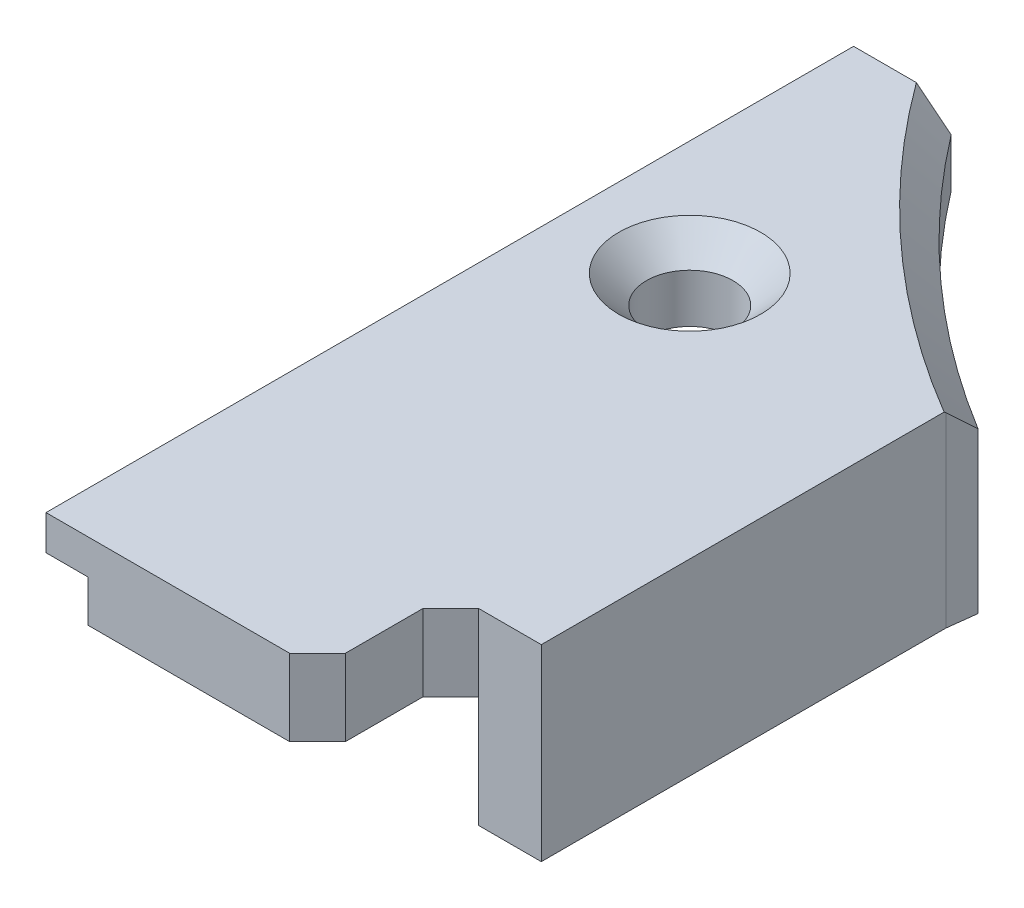
from build123d import *

# Parameters (mm, degrees)
SKETCH_234_R           = 1.55
EXTRUDE_1_DEPTH        = 2.75
SKETCH_923_W           = 10.000000002
SKETCH_923_H           = 4.75
EXTRUDE_2_DEPTH        = 2.75
SKETCH_1070_W          = 1
SKETCH_1070_H          = 6.95
EXTRUDE_1769_DEPTH     = 2.75
PCB_START              = -4
SKETCH_6_W             = 1
SKETCH_6_H             = 6.95
PCB_DEPTH              = 4
SKETCH_4_W             = 1.75
SKETCH_4_H             = 28.99988509
CUT_EXTRUDE_2211_DEPTH = 1.5
SKETCH_5_W             = 0.25
SKETCH_5_H             = 28.99988509
CUT_EXTRUDE_2_DEPTH    = 33.350081892
CHAMFER_1_SIZE         = 1
CHAMFER_2_SIZE         = 1
CUT_EXTRUDE_4_DEPTH    = 4


with BuildPart() as part:
    # Sketch 234 → 底座-1 (new body)
    with BuildSketch(Plane(origin=(0, 0, 0), x_dir=(1, 0, 0), z_dir=(0, 1, 0))):
        with BuildLine():
            Line((22.500000002, -14.24988509), (22.500000002, -7.263629174))
            Line((22.500000002, -7.263629174), (24.500000002, -7.263629174))
            Line((24.500000002, -7.263629174), (24.500000002, 0.312480077))
            Line((24.500000002, 0.312480077), (24.715186194, 2.08073674))
            ThreePointArc((24.715186194, 2.08073674), (20.15501929, 5.688743466), (16.252981126, 10))
            Line((16.252981126, 10), (12.5, 10))
            Line((12.5, 10), (12.5, -14.24988509))
            Line((12.5, -14.24988509), (22.500000002, -14.24988509))
        make_face()
        with Locations(Location((16.865979255, 0, 0), (0, 0, 270))):
            Circle(SKETCH_234_R, mode=Mode.SUBTRACT)
    extrude(amount=EXTRUDE_1_DEPTH)

    # Sketch 923 → 底座-2 (add)
    with BuildSketch(Plane(origin=(0, 0, 0), x_dir=(1, 0, 0), z_dir=(0, 1, 0))):
        with Locations((17.500000001, -16.62488509)):
            Rectangle(SKETCH_923_W, SKETCH_923_H)
    extrude(amount=EXTRUDE_2_DEPTH)

    # Sketch 1070 → Extrude 1769 (add)
    with BuildSketch(Plane(origin=(0, 0, 0), x_dir=(1, 0, 0), z_dir=(0, 1, 0))):
        with BuildLine():
            ThreePointArc((24.715186194, 2.08073674), (25.291636518, 1.705823535), (25.875319612, 1.342273079))
            Line((25.875319612, 1.342273079), (25.750000002, 0.312480077))
            Line((25.750000002, 0.312480077), (25.750000002, -14.213629174))
            Line((25.750000002, -14.213629174), (24.500000002, -14.213629174))
            Line((24.500000002, -14.213629174), (24.500000002, -7.263629174))
            Line((24.500000002, -7.263629174), (24.500000002, 0.312480077))
            Line((24.500000002, 0.312480077), (24.715186194, 2.08073674))
        make_face()
        with Locations((24.000000002, -10.738629174)):
            Rectangle(SKETCH_1070_W, SKETCH_1070_H)
        with Locations((23.000000002, -10.738629174)):
            Rectangle(SKETCH_1070_W, SKETCH_1070_H)
    extrude(amount=EXTRUDE_1769_DEPTH)

    # Sketch 6 → 底座卡榫-注意PCB突出部分 (add)
    with BuildSketch(Plane(origin=(0, 0, 0), x_dir=(1, 0, 0), z_dir=(0, 1, 0)).offset(PCB_START)):
        with Locations((24.000000002, -10.738629174)):
            Rectangle(SKETCH_6_W, SKETCH_6_H)
        with BuildLine():
            ThreePointArc((24.715186194, 2.08073674), (25.291636518, 1.705823535), (25.875319612, 1.342273079))
            Line((25.875319612, 1.342273079), (25.750000002, 0.312480077))
            Line((25.750000002, 0.312480077), (25.750000002, -14.213629174))
            Line((25.750000002, -14.213629174), (24.500000002, -14.213629174))
            Line((24.500000002, -14.213629174), (24.500000002, -7.263629174))
            Line((24.500000002, -7.263629174), (24.500000002, 0.312480077))
            Line((24.500000002, 0.312480077), (24.715186194, 2.08073674))
        make_face()
    extrude(amount=PCB_DEPTH)

    # 草图4 → Cut-Extrude 2211 (cut)
    with BuildSketch(Plane(origin=(0, 0, 0), x_dir=(1, 0, 0), z_dir=(0, 1, 0))):
        with Locations((13.375, -4.499942545)):
            Rectangle(SKETCH_4_W, SKETCH_4_H)
    extrude(amount=CUT_EXTRUDE_2211_DEPTH, mode=Mode.SUBTRACT)

    # 草图5 → 配合切除-2 (cut, through all)
    with BuildSketch(Plane(origin=(0, 0, 0), x_dir=(1, 0, 0), z_dir=(0, 1, 0))):
        with Locations((12.625, -4.499942545)):
            Rectangle(SKETCH_5_W, SKETCH_5_H)
    extrude(amount=CUT_EXTRUDE_2_DEPTH, mode=Mode.SUBTRACT)

    # 倒角1
    chamfer_1_edges = [part.edges().sort_by_distance(p)[0] for p in [
        (22.500000002, 1.375, 18.99988509),
        (20.661675073, 2.75, -5.223818951),
        (22.500000002, 1.375, 14.213629174),
    ]]
    chamfer(chamfer_1_edges, length=CHAMFER_1_SIZE)

    # 倒角2
    chamfer_2_edges = [part.edges().sort_by_distance(p)[0] for p in [
        (16.865979255, 2.75, -1.55),
    ]]
    chamfer(chamfer_2_edges, length=CHAMFER_2_SIZE)

    # Sketch 6 2 → 切除-拉伸4 (cut)
    with BuildSketch(Plane.XZ.offset(4)):
        with BuildLine():
            Line((24.715186194, -2.08073674), (24.500000002, -0.312480077))
            Line((24.500000002, -0.312480077), (24.500000002, 7.263629174))
            Line((24.500000002, 7.263629174), (23.500000002, 7.263629174))
            Line((23.500000002, 7.263629174), (23.500000002, 7.513629174))
            Line((23.500000002, 7.513629174), (24.750000002, 7.513629174))
            Line((24.750000002, 7.513629174), (24.750000002, -0.312480077))
            Line((24.750000002, -0.312480077), (24.946632534, -1.928275128))
            ThreePointArc((24.946632534, -1.928275128), (24.830758909, -2.004277534), (24.715186194, -2.08073674))
        make_face()
    extrude(amount=-CUT_EXTRUDE_4_DEPTH, mode=Mode.SUBTRACT)


solid = part.part
